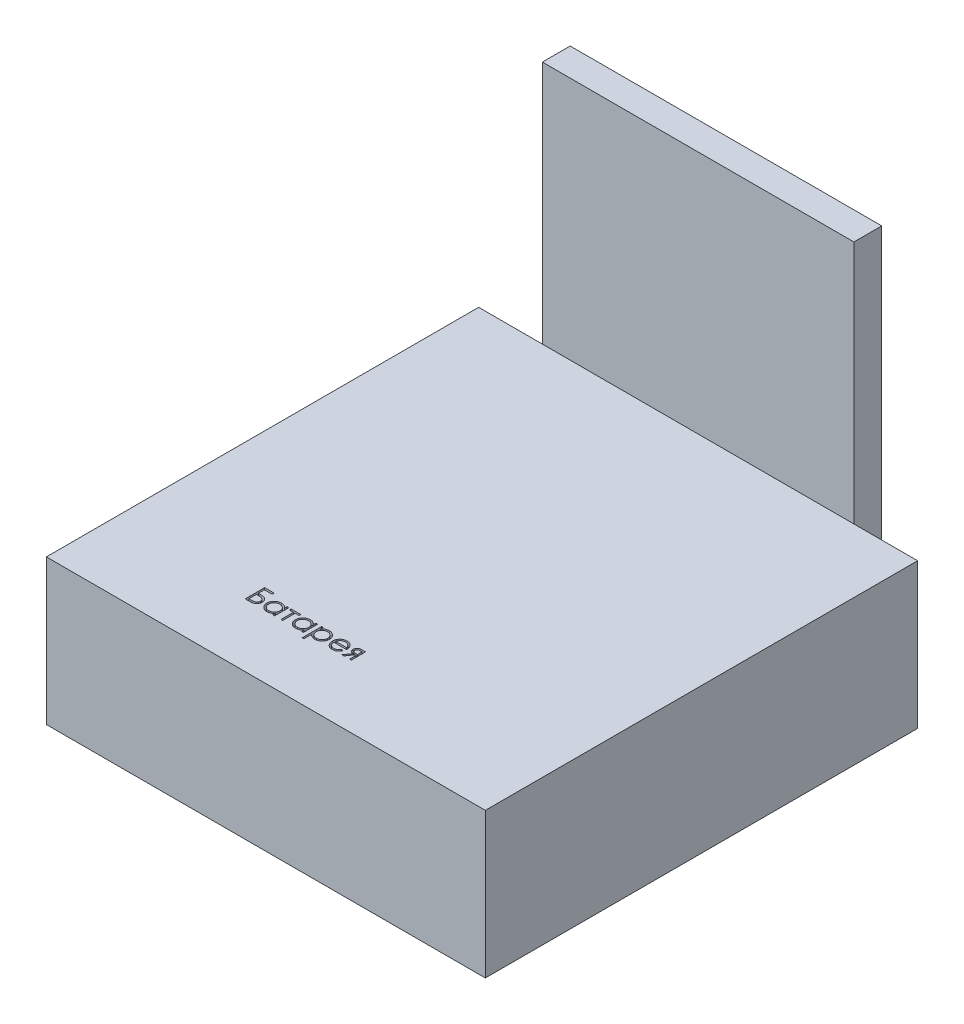
from build123d import *

# Parameters (mm, degrees)
SKETCH_1_W          = 78.9
SKETCH_1_H          = 77.7
EXTRUDE_1_DEPTH     = 26.1
SKETCH_2_W          = 56
SKETCH_2_H          = 70
EXTRUDE_2_DEPTH     = 5
CUT_EXTRUDE_1_DEPTH = 2


with BuildPart() as part:
    # Эскиз1 → Бобышка-Вытянуть1 (new body)
    with BuildSketch(Plane(origin=(0, 0, 0), x_dir=(1, 0, 0), z_dir=(0, 1, 0))):
        Rectangle(SKETCH_1_W, SKETCH_1_H)
    extrude(amount=EXTRUDE_1_DEPTH)

    # Эскиз2 → Бобышка-Вытянуть2 (add)
    with BuildSketch(Plane(origin=(0, 0, -38.85), x_dir=(-1, 0, 0), z_dir=(0, 0, -1))):
        with Locations((0, 35)):
            Rectangle(SKETCH_2_W, SKETCH_2_H)
    extrude(amount=EXTRUDE_2_DEPTH)

    # Эскиз3 → Вырез-Вытянуть1 (cut)
    # profile 1 of 7: a face of its own
    with BuildSketch(Plane(origin=(0, 26.1, 0), x_dir=(1, 0, 0), z_dir=(0, 1, 0))):
        with BuildLine():
            Line((-15.046925595, -27.515967533), (-15.046925595, -24.015967533))
            Line((-15.046925595, -24.015967533), (-13.34179739, -24.015967533))
            Line((-13.34179739, -24.015967533), (-13.34179739, -24.374941892))
            Line((-13.34179739, -24.374941892), (-14.732823031, -24.374941892))
            Line((-14.732823031, -24.374941892), (-14.732823031, -25.451864968))
            Line((-14.732823031, -25.451864968), (-14.568760531, -25.451864968))
            add(Edge.make_bspline(
                [(-14.568760531, -25.451864968), (-14.516173328, -25.452374539), (-14.414481841, -25.453359932), (-14.267633745, -25.457887542), (-14.131954982, -25.466693536), (-14.007646498, -25.480445946), (-13.894211782, -25.49564601), (-13.792003014, -25.516248801), (-13.70096045, -25.539471013), (-13.61984913, -25.567238351), (-13.546942061, -25.599584406), (-13.478263971, -25.634283471), (-13.414424222, -25.674778427), (-13.353895611, -25.718679387), (-13.297924701, -25.767535752), (-13.244709257, -25.819309944), (-13.196430375, -25.876330214), (-13.152596853, -25.937320138), (-13.112424184, -26.00071343), (-13.078348078, -26.066882628), (-13.048551981, -26.134144185), (-13.024632293, -26.203613146), (-13.005684504, -26.274812608), (-12.9923796, -26.347958881), (-12.984570227, -26.422747979), (-12.983409921, -26.473147444), (-12.982823031, -26.498639808)],
                knots=[0, 0, 0, 0, 1.752767101, 3.389446175, 4.896203737, 6.282845301, 7.557379853, 8.70920821, 9.755888069, 10.687037128, 11.562572166, 12.412614865, 13.249022037, 14.079422943, 14.902337317, 15.723036774, 16.551865261, 17.38856255, 18.224969721, 19.050681129, 19.866895551, 20.674891587, 21.496773076, 22.320277089, 23.150385677, 24, 24, 24, 24], degree=3))
            add(Edge.make_bspline(
                [(-12.982823031, -26.498639808), (-12.983879099, -26.531864609), (-12.985969912, -26.597643371), (-12.999217081, -26.694775003), (-13.022676876, -26.788649616), (-13.05514546, -26.879489253), (-13.096391961, -26.967657501), (-13.148405948, -27.051762356), (-13.207923201, -27.133760427), (-13.277130388, -27.210838888), (-13.353794323, -27.282732944), (-13.439006542, -27.345289653), (-13.531776327, -27.398211261), (-13.631647863, -27.441755194), (-13.738850731, -27.475396956), (-13.852989122, -27.499053464), (-13.974321707, -27.513169537), (-14.057604145, -27.515017621), (-14.100411172, -27.515967533)],
                knots=[0, 0, 0, 0, 0.942308546, 1.865590965, 2.773834697, 3.681570429, 4.597712081, 5.528670488, 6.481825442, 7.467627989, 8.461905466, 9.457463404, 10.457951184, 11.484916399, 12.54140054, 13.638517739, 14.786202266, 16, 16, 16, 16], degree=3))
            Line((-14.100411172, -27.515967533), (-15.046925595, -27.515967533))
        make_face()
        with BuildLine():
            Line((-14.732823031, -25.810839327), (-14.732823031, -27.156993174))
            Line((-14.732823031, -27.156993174), (-14.285507326, -27.156993174))
            add(Edge.make_bspline(
                [(-14.285507326, -27.156993174), (-14.253485601, -27.156694461), (-14.191526142, -27.156116475), (-14.101987755, -27.152540521), (-14.01893086, -27.147276422), (-13.94269769, -27.138829659), (-13.87299833, -27.128321542), (-13.809863558, -27.116193503), (-13.753495352, -27.100604024), (-13.687784776, -27.077807348), (-13.614394486, -27.041432664), (-13.534720547, -26.988686536), (-13.464809739, -26.925022009), (-13.405238562, -26.851917111), (-13.356795348, -26.771822703), (-13.321902884, -26.685746552), (-13.300961265, -26.594758186), (-13.298284625, -26.532403156), (-13.296925595, -26.500743174)],
                knots=[0, 0, 0, 0, 1.143896666, 2.213347964, 3.200758521, 4.116267265, 4.952224007, 5.718489261, 6.411181601, 7.039613526, 8.200836304, 9.326180736, 10.443194696, 11.564568115, 12.684230914, 13.774114808, 14.86983476, 16, 16, 16, 16], degree=3))
            add(Edge.make_bspline(
                [(-13.296925595, -26.500743174), (-13.297191307, -26.480848201), (-13.297715488, -26.441600561), (-13.30599118, -26.384193812), (-13.317845589, -26.328805759), (-13.334329362, -26.275468742), (-13.357138408, -26.225028019), (-13.384136115, -26.176727582), (-13.41544889, -26.130434241), (-13.464332172, -26.072842985), (-13.53295729, -26.008205348), (-13.626113319, -25.94385766), (-13.729514557, -25.895377853), (-13.823373042, -25.867642717), (-13.904807883, -25.851456486), (-13.973289414, -25.84013484), (-14.048890169, -25.831336745), (-14.13138488, -25.823458204), (-14.221197545, -25.818192151), (-14.317962899, -25.814027582), (-14.421740077, -25.811013999), (-14.493270822, -25.810898799), (-14.530198832, -25.810839327)],
                knots=[0, 0, 0, 0, 0.745694433, 1.471062404, 2.170974676, 2.869732838, 3.560525162, 4.243483851, 4.943835283, 5.65329213, 7.073640697, 8.467108435, 9.882903723, 11.339060524, 12.126567834, 12.997150682, 13.942162707, 14.981203314, 16.105622371, 17.316668913, 18.614720415, 20, 20, 20, 20], degree=3))
            Line((-14.530198832, -25.810839327), (-14.732823031, -25.810839327))
        make_face(mode=Mode.SUBTRACT)
    # profile 2 of 7: a face of its own
    with BuildSketch(Plane(origin=(0, 26.1, 0), x_dir=(1, 0, 0), z_dir=(0, 1, 0))):
        with BuildLine():
            Line((-9.7520538, -24.958275225), (-9.7520538, -27.515967533))
            Line((-9.7520538, -27.515967533), (-10.066156364, -27.515967533))
            Line((-10.066156364, -27.515967533), (-10.066156364, -27.07355968))
            add(Edge.make_bspline(
                [(-10.066156364, -27.07355968), (-10.101575155, -27.113599274), (-10.17069537, -27.191737045), (-10.286136488, -27.293819218), (-10.408504666, -27.378197539), (-10.537205987, -27.446347455), (-10.672124231, -27.497539511), (-10.812960318, -27.53392567), (-10.959771699, -27.557319505), (-11.060024054, -27.559655527), (-11.110827839, -27.560839327)],
                knots=[0, 0, 0, 0, 1.074387032, 2.096679803, 3.090159297, 4.057316773, 5.018401886, 5.985159533, 6.978961417, 8, 8, 8, 8], degree=3))
            add(Edge.make_bspline(
                [(-11.110827839, -27.560839327), (-11.155995793, -27.559612955), (-11.245068998, -27.557194495), (-11.376098075, -27.538432191), (-11.502190324, -27.508301569), (-11.623464897, -27.46640068), (-11.739137042, -27.410819858), (-11.850197139, -27.34427861), (-11.956069831, -27.26503778), (-12.05514137, -27.174449752), (-12.14637337, -27.076054765), (-12.226434643, -26.971109218), (-12.293187723, -26.860066914), (-12.349007803, -26.74433376), (-12.392004148, -26.623018841), (-12.421977782, -26.496541673), (-12.440718229, -26.365051799), (-12.443135689, -26.275512276), (-12.444361493, -26.230110161)],
                knots=[0, 0, 0, 0, 1.033919861, 2.038935746, 3.024066025, 3.998881131, 4.97069526, 5.957263378, 6.95902576, 7.993208707, 9.027059324, 10.027763471, 11.009749337, 11.988697705, 12.965288445, 13.950418724, 14.960734635, 16, 16, 16, 16], degree=3))
            add(Edge.make_bspline(
                [(-12.444361493, -26.230110161), (-12.443108521, -26.185646457), (-12.440631464, -26.097744114), (-12.422178245, -25.968465416), (-12.391147236, -25.843947155), (-12.347599388, -25.724590212), (-12.291757433, -25.610250162), (-12.223829346, -25.500846137), (-12.143810222, -25.396076739), (-12.051557815, -25.298405512), (-11.951623044, -25.208184898), (-11.844714313, -25.129775853), (-11.733491032, -25.062059004), (-11.616228022, -25.008405528), (-11.494660917, -24.964996423), (-11.367707471, -24.934963455), (-11.235895892, -24.917266134), (-11.1464054, -24.91470337), (-11.101012134, -24.91340343)],
                knots=[0, 0, 0, 0, 1.020392517, 2.01726096, 2.990465484, 3.961182959, 4.928053699, 5.906110375, 6.912531644, 7.948652711, 8.985773172, 9.998621852, 10.987621588, 11.969261332, 12.953316658, 13.946091881, 14.958173133, 16, 16, 16, 16], degree=3))
            add(Edge.make_bspline(
                [(-11.101012134, -24.91340343), (-11.048812275, -24.914841182), (-10.946450815, -24.917660544), (-10.796722805, -24.941123272), (-10.655078327, -24.980761739), (-10.520423975, -25.034679237), (-10.393243289, -25.106327966), (-10.274740305, -25.196707927), (-10.163674822, -25.305249114), (-10.09929453, -25.388619559), (-10.066156364, -25.431532436)],
                knots=[0, 0, 0, 0, 1.038897134, 2.037228247, 3.008116434, 3.962042015, 4.918381754, 5.904844433, 6.921570401, 8, 8, 8, 8], degree=3))
            Line((-10.066156364, -25.431532436), (-10.066156364, -24.958275225))
            Line((-10.066156364, -24.958275225), (-9.7520538, -24.958275225))
        make_face()
        with BuildLine():
            add(Edge.make_bspline(
                [(-11.096805403, -25.227505994), (-11.142719741, -25.229139632), (-11.233347341, -25.232364173), (-11.366391343, -25.257537668), (-11.493704757, -25.299422262), (-11.614650831, -25.356704164), (-11.727319048, -25.4287329), (-11.828012719, -25.515854283), (-11.91755542, -25.615691298), (-11.992863684, -25.727793408), (-12.054254181, -25.847971499), (-12.097421213, -25.973595937), (-12.12589046, -26.102400915), (-12.128798981, -26.189763601), (-12.130258929, -26.23361577)],
                knots=[0, 0, 0, 0, 1.031046209, 2.035121221, 3.029706178, 4.034933723, 5.034054252, 6.02443088, 7.017295772, 8.038157696, 9.050218397, 10.03989886, 11.016116709, 12, 12, 12, 12], degree=3))
            add(Edge.make_bspline(
                [(-12.130258929, -26.23361577), (-12.128394035, -26.277205877), (-12.124671558, -26.364215233), (-12.097920864, -26.49319581), (-12.053040991, -26.618849852), (-11.991798928, -26.740110845), (-11.915112303, -26.852694946), (-11.826223651, -26.954435068), (-11.724273369, -27.041924656), (-11.611345862, -27.11516223), (-11.490737892, -27.174324751), (-11.36390396, -27.21549039), (-11.233228322, -27.242068171), (-11.144375988, -27.245172648), (-11.09960989, -27.246736763)],
                knots=[0, 0, 0, 0, 0.979072187, 1.954306742, 2.945804271, 3.96968567, 4.997920485, 5.998718438, 6.996577872, 8.005894225, 9.015743152, 10.005417472, 10.995077863, 12, 12, 12, 12], degree=3))
            add(Edge.make_bspline(
                [(-11.09960989, -27.246736763), (-11.054163387, -27.245076799), (-10.963774801, -27.241775296), (-10.830336093, -27.216494031), (-10.70084113, -27.174725232), (-10.577053902, -27.116826105), (-10.461737771, -27.04506875), (-10.358239893, -26.961061658), (-10.270723925, -26.863358474), (-10.196531315, -26.755982021), (-10.138355898, -26.638270025), (-10.095979839, -26.512935834), (-10.070925933, -26.379975086), (-10.067768204, -26.289111159), (-10.066156364, -26.242730353)],
                knots=[0, 0, 0, 0, 1.01762866, 2.023962475, 3.030623092, 4.058876274, 5.077231937, 6.066672613, 7.034107872, 8.005628644, 8.981990164, 9.965428785, 10.961468474, 12, 12, 12, 12], degree=3))
            add(Edge.make_bspline(
                [(-10.066156364, -26.242730353), (-10.067116021, -26.207392523), (-10.069004928, -26.137836489), (-10.083435498, -26.035708972), (-10.106390424, -25.937975246), (-10.138736594, -25.844532557), (-10.181227879, -25.755897541), (-10.232475644, -25.671433781), (-10.293381094, -25.59158057), (-10.36296379, -25.517437499), (-10.439128993, -25.449811036), (-10.519723534, -25.389446796), (-10.60570228, -25.339858023), (-10.695619317, -25.298816751), (-10.789630652, -25.266157601), (-10.888501272, -25.244369908), (-10.991180259, -25.229409587), (-11.061226314, -25.228147206), (-11.096805403, -25.227505994)],
                knots=[0, 0, 0, 0, 1.050140795, 2.067009409, 3.05949893, 4.030605086, 5.00011959, 5.97591094, 6.962425594, 7.979863591, 8.993523472, 9.986985069, 10.967611495, 11.937549037, 12.921786183, 13.919465291, 14.943216303, 16, 16, 16, 16], degree=3))
        make_face(mode=Mode.SUBTRACT)
    # profile 3 of 7: a face of its own
    with BuildSketch(Plane(origin=(0, 26.1, 0), x_dir=(1, 0, 0), z_dir=(0, 1, 0))):
        Polygon((-9.348207646, -24.958275225), (-7.598207646, -24.958275225), (-7.598207646, -25.272377789), (-8.316156364, -25.272377789), (-8.316156364, -27.515967533), (-8.630258929, -27.515967533), (-8.630258929, -25.272377789), (-9.348207646, -25.272377789), align=None)
    # profile 4 of 7: a face of its own
    with BuildSketch(Plane(origin=(0, 26.1, 0), x_dir=(1, 0, 0), z_dir=(0, 1, 0))):
        with BuildLine():
            Line((-4.59179739, -24.958275225), (-4.59179739, -27.515967533))
            Line((-4.59179739, -27.515967533), (-4.905899954, -27.515967533))
            Line((-4.905899954, -27.515967533), (-4.905899954, -27.07355968))
            add(Edge.make_bspline(
                [(-4.905899954, -27.07355968), (-4.941318745, -27.113599274), (-5.01043896, -27.191737045), (-5.125880078, -27.293819218), (-5.248248256, -27.378197539), (-5.376949577, -27.446347455), (-5.51186782, -27.497539511), (-5.652703908, -27.53392567), (-5.799515289, -27.557319505), (-5.899767643, -27.559655527), (-5.950571429, -27.560839327)],
                knots=[0, 0, 0, 0, 1.074387032, 2.096679803, 3.090159297, 4.057316773, 5.018401886, 5.985159533, 6.978961417, 8, 8, 8, 8], degree=3))
            add(Edge.make_bspline(
                [(-5.950571429, -27.560839327), (-5.995739382, -27.559612955), (-6.084812587, -27.557194495), (-6.215841664, -27.538432191), (-6.341933914, -27.508301569), (-6.463208487, -27.46640068), (-6.578880632, -27.410819858), (-6.689940729, -27.34427861), (-6.795813421, -27.26503778), (-6.89488496, -27.174449752), (-6.98611696, -27.076054765), (-7.066178233, -26.971109218), (-7.132931312, -26.860066914), (-7.188751393, -26.74433376), (-7.231747738, -26.623018841), (-7.261721372, -26.496541673), (-7.280461819, -26.365051799), (-7.282879279, -26.275512276), (-7.284105082, -26.230110161)],
                knots=[0, 0, 0, 0, 1.033919861, 2.038935746, 3.024066025, 3.998881131, 4.97069526, 5.957263378, 6.95902576, 7.993208707, 9.027059324, 10.027763471, 11.009749337, 11.988697705, 12.965288445, 13.950418724, 14.960734635, 16, 16, 16, 16], degree=3))
            add(Edge.make_bspline(
                [(-7.284105082, -26.230110161), (-7.282852111, -26.185646457), (-7.280375054, -26.097744114), (-7.261921834, -25.968465416), (-7.230890826, -25.843947155), (-7.187342978, -25.724590212), (-7.131501023, -25.610250162), (-7.063572936, -25.500846137), (-6.983553811, -25.396076739), (-6.891301404, -25.298405512), (-6.791366634, -25.208184898), (-6.684457903, -25.129775853), (-6.573234622, -25.062059004), (-6.455971611, -25.008405528), (-6.334404507, -24.964996423), (-6.207451061, -24.934963455), (-6.075639482, -24.917266134), (-5.98614899, -24.91470337), (-5.940755723, -24.91340343)],
                knots=[0, 0, 0, 0, 1.020392517, 2.01726096, 2.990465484, 3.961182959, 4.928053699, 5.906110375, 6.912531644, 7.948652711, 8.985773172, 9.998621852, 10.987621588, 11.969261332, 12.953316658, 13.946091881, 14.958173133, 16, 16, 16, 16], degree=3))
            add(Edge.make_bspline(
                [(-5.940755723, -24.91340343), (-5.888555864, -24.914841182), (-5.786194404, -24.917660544), (-5.636466395, -24.941123272), (-5.494821917, -24.980761739), (-5.360167565, -25.034679237), (-5.232986879, -25.106327966), (-5.114483895, -25.196707927), (-5.003418411, -25.305249114), (-4.93903812, -25.388619559), (-4.905899954, -25.431532436)],
                knots=[0, 0, 0, 0, 1.038897134, 2.037228247, 3.008116434, 3.962042015, 4.918381754, 5.904844433, 6.921570401, 8, 8, 8, 8], degree=3))
            Line((-4.905899954, -25.431532436), (-4.905899954, -24.958275225))
            Line((-4.905899954, -24.958275225), (-4.59179739, -24.958275225))
        make_face()
        with BuildLine():
            add(Edge.make_bspline(
                [(-5.936548993, -25.227505994), (-5.982463331, -25.229139632), (-6.07309093, -25.232364173), (-6.206134933, -25.257537668), (-6.333448347, -25.299422262), (-6.454394421, -25.356704164), (-6.567062638, -25.4287329), (-6.667756308, -25.515854283), (-6.75729901, -25.615691298), (-6.832607274, -25.727793408), (-6.893997771, -25.847971499), (-6.937164803, -25.973595937), (-6.96563405, -26.102400915), (-6.968542571, -26.189763601), (-6.970002518, -26.23361577)],
                knots=[0, 0, 0, 0, 1.031046209, 2.035121221, 3.029706178, 4.034933723, 5.034054252, 6.02443088, 7.017295772, 8.038157696, 9.050218397, 10.03989886, 11.016116709, 12, 12, 12, 12], degree=3))
            add(Edge.make_bspline(
                [(-6.970002518, -26.23361577), (-6.968137625, -26.277205877), (-6.964415148, -26.364215233), (-6.937664454, -26.49319581), (-6.89278458, -26.618849852), (-6.831542518, -26.740110845), (-6.754855893, -26.852694946), (-6.66596724, -26.954435068), (-6.564016959, -27.041924656), (-6.451089452, -27.11516223), (-6.330481481, -27.174324751), (-6.20364755, -27.21549039), (-6.072971912, -27.242068171), (-5.984119578, -27.245172648), (-5.93935348, -27.246736763)],
                knots=[0, 0, 0, 0, 0.979072187, 1.954306742, 2.945804271, 3.96968567, 4.997920485, 5.998718438, 6.996577872, 8.005894225, 9.015743152, 10.005417472, 10.995077863, 12, 12, 12, 12], degree=3))
            add(Edge.make_bspline(
                [(-5.93935348, -27.246736763), (-5.893906977, -27.245076799), (-5.803518391, -27.241775296), (-5.670079683, -27.216494031), (-5.54058472, -27.174725232), (-5.416797491, -27.116826105), (-5.30148136, -27.04506875), (-5.197983483, -26.961061658), (-5.110467514, -26.863358474), (-5.036274905, -26.755982021), (-4.978099488, -26.638270025), (-4.935723429, -26.512935834), (-4.910669523, -26.379975086), (-4.907511793, -26.289111159), (-4.905899954, -26.242730353)],
                knots=[0, 0, 0, 0, 1.01762866, 2.023962475, 3.030623092, 4.058876274, 5.077231937, 6.066672613, 7.034107872, 8.005628644, 8.981990164, 9.965428785, 10.961468474, 12, 12, 12, 12], degree=3))
            add(Edge.make_bspline(
                [(-4.905899954, -26.242730353), (-4.906859611, -26.207392523), (-4.908748518, -26.137836489), (-4.923179088, -26.035708972), (-4.946134014, -25.937975246), (-4.978480184, -25.844532557), (-5.020971468, -25.755897541), (-5.072219234, -25.671433781), (-5.133124684, -25.59158057), (-5.20270738, -25.517437499), (-5.278872583, -25.449811036), (-5.359467123, -25.389446796), (-5.44544587, -25.339858023), (-5.535362907, -25.298816751), (-5.629374242, -25.266157601), (-5.728244861, -25.244369908), (-5.830923848, -25.229409587), (-5.900969904, -25.228147206), (-5.936548993, -25.227505994)],
                knots=[0, 0, 0, 0, 1.050140795, 2.067009409, 3.05949893, 4.030605086, 5.00011959, 5.97591094, 6.962425594, 7.979863591, 8.993523472, 9.986985069, 10.967611495, 11.937549037, 12.921786183, 13.919465291, 14.943216303, 16, 16, 16, 16], degree=3))
        make_face(mode=Mode.SUBTRACT)
    # profile 5 of 7: a face of its own
    with BuildSketch(Plane(origin=(0, 26.1, 0), x_dir=(1, 0, 0), z_dir=(0, 1, 0))):
        with BuildLine():
            Line((-3.873848672, -24.958275225), (-3.559746108, -24.958275225))
            Line((-3.559746108, -24.958275225), (-3.559746108, -25.431532436))
            add(Edge.make_bspline(
                [(-3.559746108, -25.431532436), (-3.526388624, -25.388594703), (-3.461565029, -25.30515381), (-3.349840124, -25.197163681), (-3.231913315, -25.106088377), (-3.104749903, -25.034705844), (-2.970326213, -24.980885033), (-2.829193896, -24.941105583), (-2.680155131, -24.917664108), (-2.578258678, -24.914842447), (-2.526292582, -24.91340343)],
                knots=[0, 0, 0, 0, 1.0828784, 2.104357462, 3.088488658, 4.04616522, 5.001424249, 5.969181776, 6.964304535, 8, 8, 8, 8], degree=3))
            add(Edge.make_bspline(
                [(-2.526292582, -24.91340343), (-2.480900979, -24.914716609), (-2.391182091, -24.917312176), (-2.259118862, -24.934885231), (-2.131943478, -24.965002923), (-2.010375424, -25.008403838), (-1.893112359, -25.062059308), (-1.781890259, -25.129776344), (-1.674976704, -25.208182535), (-1.575060515, -25.298414685), (-1.482739147, -25.396042952), (-1.402892966, -25.501065256), (-1.334021062, -25.610027842), (-1.278350765, -25.724619935), (-1.234742418, -25.843939164), (-1.20372774, -25.968467605), (-1.185270097, -26.097743546), (-1.182793645, -26.185646266), (-1.18154098, -26.230110161)],
                knots=[0, 0, 0, 0, 1.041296284, 2.058176809, 3.050446431, 4.034000596, 5.01514041, 6.003636468, 7.015969324, 8.052561599, 9.08815499, 10.094063707, 11.074456064, 12.040834395, 13.011057502, 13.983766392, 14.980127149, 16, 16, 16, 16], degree=3))
            add(Edge.make_bspline(
                [(-1.18154098, -26.230110161), (-1.182766465, -26.275512469), (-1.1851833, -26.365052374), (-1.203928306, -26.496539471), (-1.23388518, -26.623026845), (-1.276943363, -26.744304108), (-1.332584851, -26.86028776), (-1.400289412, -26.970894156), (-1.480175879, -27.076087859), (-1.571477006, -27.174440759), (-1.670529943, -27.265040072), (-1.776407432, -27.344278142), (-1.887466358, -27.410819517), (-2.003138525, -27.466402476), (-2.124414163, -27.50829466), (-2.250727441, -27.538512461), (-2.382009587, -27.557146957), (-2.471310739, -27.559599099), (-2.516476877, -27.560839327)],
                knots=[0, 0, 0, 0, 1.038740735, 2.04854663, 3.033179607, 4.009277356, 4.987731542, 5.972001279, 6.972200261, 8.005528982, 9.039189865, 10.040446548, 11.026516639, 11.997840187, 12.972163198, 13.956796175, 14.96660207, 16, 16, 16, 16], degree=3))
            add(Edge.make_bspline(
                [(-2.516476877, -27.560839327), (-2.567304449, -27.55954452), (-2.667703805, -27.556986895), (-2.814501476, -27.531067485), (-2.955778328, -27.492330549), (-3.089969152, -27.435631556), (-3.218136965, -27.36337604), (-3.339556771, -27.275265834), (-3.454873523, -27.171485209), (-3.524282281, -27.092753393), (-3.559746108, -27.052526026)],
                knots=[0, 0, 0, 0, 1.014726462, 2.004382257, 2.969841629, 3.936926163, 4.907207904, 5.903978561, 6.929055279, 8, 8, 8, 8], degree=3))
            Line((-3.559746108, -27.052526026), (-3.559746108, -28.458275225))
            Line((-3.559746108, -28.458275225), (-3.873848672, -28.458275225))
            Line((-3.873848672, -28.458275225), (-3.873848672, -24.958275225))
        make_face()
        with BuildLine():
            add(Edge.make_bspline(
                [(-2.52909707, -25.227505994), (-2.564676632, -25.228146252), (-2.63472362, -25.229406756), (-2.737395839, -25.244380704), (-2.836291267, -25.266118446), (-2.930413218, -25.299030346), (-3.020663834, -25.339429159), (-3.106347999, -25.38991117), (-3.187405567, -25.449563176), (-3.263632597, -25.51724252), (-3.332495891, -25.591817208), (-3.393458819, -25.671405017), (-3.444666124, -25.755905157), (-3.487168144, -25.844530519), (-3.519511427, -25.937975805), (-3.542467146, -26.035708817), (-3.556897499, -26.13783653), (-3.558786436, -26.207392536), (-3.559746108, -26.242730353)],
                knots=[0, 0, 0, 0, 1.05670511, 2.080379991, 3.077984906, 4.06214886, 5.038337365, 6.01289324, 7.01187578, 8.025460281, 9.038092164, 10.024533457, 11.000252242, 11.969694649, 12.940728589, 13.933144304, 14.949937299, 16, 16, 16, 16], degree=3))
            add(Edge.make_bspline(
                [(-3.559746108, -26.242730353), (-3.558155252, -26.289118466), (-3.55503863, -26.379996707), (-3.529701262, -26.512780829), (-3.488465998, -26.638432484), (-3.429937284, -26.755893521), (-3.35598971, -26.863876356), (-3.266891554, -26.960566963), (-3.163449003, -27.045357554), (-3.047381811, -27.116778808), (-2.92295968, -27.174766874), (-2.793173768, -27.216281084), (-2.659808887, -27.241853313), (-2.569640568, -27.245100132), (-2.524189217, -27.246736763)],
                knots=[0, 0, 0, 0, 1.03728447, 2.032128127, 3.01272805, 3.987917167, 4.958271349, 5.931593992, 6.91984656, 7.941419022, 8.973179163, 9.983609215, 10.983593296, 12, 12, 12, 12], degree=3))
            add(Edge.make_bspline(
                [(-2.524189217, -27.246736763), (-2.479653449, -27.245180386), (-2.391257956, -27.242091258), (-2.261099835, -27.215353071), (-2.134609196, -27.174508046), (-2.014429024, -27.11494849), (-1.901605536, -27.041958432), (-1.799723982, -26.954398398), (-1.710717069, -26.852908455), (-1.634852714, -26.739899952), (-1.573721228, -26.618724569), (-1.527790989, -26.49334318), (-1.501282415, -26.364197757), (-1.497525627, -26.277200044), (-1.495643544, -26.23361577)],
                knots=[0, 0, 0, 0, 1.00104056, 1.986885549, 2.97790532, 3.984399681, 4.995088187, 5.994304198, 6.996462723, 8.023150851, 9.048424203, 10.043036403, 11.019596776, 12, 12, 12, 12], degree=3))
            add(Edge.make_bspline(
                [(-1.495643544, -26.23361577), (-1.497098278, -26.189760781), (-1.499996412, -26.102392477), (-1.528543449, -25.973629574), (-1.571443427, -25.847741598), (-1.634002479, -25.728221048), (-1.708203748, -25.615446965), (-1.797950745, -25.515893087), (-1.898566942, -25.428722414), (-2.011256106, -25.356707004), (-2.132196531, -25.299421509), (-2.259511447, -25.25753787), (-2.39255505, -25.232364121), (-2.483182704, -25.229139614), (-2.52909707, -25.227505994)],
                knots=[0, 0, 0, 0, 0.983928682, 1.960191568, 2.949917689, 3.96440592, 4.982380491, 5.975291189, 6.965713506, 7.964880129, 8.970154049, 9.96478489, 10.968906225, 12, 12, 12, 12], degree=3))
        make_face(mode=Mode.SUBTRACT)
    # profile 6 of 7: a face of its own
    with BuildSketch(Plane(origin=(0, 26.1, 0), x_dir=(1, 0, 0), z_dir=(0, 1, 0))):
        with BuildLine():
            Line((1.545822802, -26.708275225), (1.824869277, -26.85480968))
            add(Edge.make_bspline(
                [(1.824869277, -26.85480968), (1.802632681, -26.894253011), (1.759369073, -26.970994114), (1.684968325, -27.076425975), (1.606976252, -27.17127369), (1.521872284, -27.253003345), (1.432202605, -27.32425473), (1.337469951, -27.386592554), (1.237181133, -27.439711075), (1.131331408, -27.484463603), (1.019031857, -27.518873097), (0.900010341, -27.543177318), (0.774038845, -27.558200586), (0.687692665, -27.559945727), (0.643479052, -27.560839327)],
                knots=[0, 0, 0, 0, 1.120438281, 2.179929193, 3.190490725, 4.156257408, 5.095198341, 6.022838206, 6.959905092, 7.901321166, 8.864066838, 9.862729781, 10.905609505, 12, 12, 12, 12], degree=3))
            add(Edge.make_bspline(
                [(0.643479052, -27.560839327), (0.594337075, -27.559692152), (0.498475313, -27.557454345), (0.358935566, -27.538161881), (0.227556148, -27.506689522), (0.104344444, -27.462723981), (-0.010397808, -27.405296657), (-0.116898663, -27.335337175), (-0.215718189, -27.25320492), (-0.303742398, -27.158188477), (-0.382986281, -27.056506519), (-0.452912101, -26.950550635), (-0.511369532, -26.84058741), (-0.558922142, -26.727316886), (-0.597327007, -26.611452993), (-0.624093711, -26.491941525), (-0.639523459, -26.369105941), (-0.641887904, -26.286008605), (-0.643079441, -26.244132597)],
                knots=[0, 0, 0, 0, 1.145258523, 2.234067595, 3.276747158, 4.290159414, 5.277019952, 6.260822364, 7.254936242, 8.264827045, 9.274100331, 10.257902744, 11.220704747, 12.172965371, 13.118907548, 14.062713208, 15.023725156, 16, 16, 16, 16], degree=3))
            add(Edge.make_bspline(
                [(-0.643079441, -26.244132597), (-0.6420203, -26.204837766), (-0.639921222, -26.126960602), (-0.626690434, -26.011695057), (-0.603242141, -25.899666605), (-0.571065817, -25.790782157), (-0.529514571, -25.685224023), (-0.478682352, -25.582927959), (-0.418489974, -25.484002819), (-0.3720173, -25.421599685), (-0.348608288, -25.390166251)],
                knots=[0, 0, 0, 0, 1.024358464, 2.0301432, 3.019427413, 4.004406732, 4.986367066, 5.972626655, 6.978780325, 8, 8, 8, 8], degree=3))
            add(Edge.make_bspline(
                [(-0.348608288, -25.390166251), (-0.316900605, -25.35229738), (-0.254489658, -25.27775923), (-0.148933303, -25.179820904), (-0.034633106, -25.097777129), (0.08697852, -25.029769993), (0.217314994, -24.978096346), (0.354624285, -24.939588764), (0.500469871, -24.918010753), (0.600175092, -24.914962919), (0.651191392, -24.91340343)],
                knots=[0, 0, 0, 0, 1.030682036, 2.02871468, 2.997146059, 3.962720338, 4.930598197, 5.918074684, 6.934738563, 8, 8, 8, 8], degree=3))
            add(Edge.make_bspline(
                [(0.651191392, -24.91340343), (0.703638997, -24.914757479), (0.806529243, -24.917413814), (0.956561364, -24.942040148), (1.098522081, -24.981092702), (1.232354585, -25.036246493), (1.358072446, -25.107406044), (1.474858495, -25.195547886), (1.584710008, -25.297965973), (1.648618587, -25.376729183), (1.681139309, -25.416808879)],
                knots=[0, 0, 0, 0, 1.056321875, 2.072262726, 3.055038591, 4.01806755, 4.982017516, 5.957941055, 6.960871419, 8, 8, 8, 8], degree=3))
            add(Edge.make_bspline(
                [(1.681139309, -25.416808879), (1.703266247, -25.44701246), (1.74737284, -25.507218579), (1.80261994, -25.605389736), (1.850577335, -25.70810033), (1.888910296, -25.817010627), (1.919949797, -25.930830208), (1.942406616, -26.050372752), (1.955576235, -26.175602664), (1.958164932, -26.260929219), (1.959484661, -26.304429071)],
                knots=[0, 0, 0, 0, 0.94817472, 1.890038105, 2.849395472, 3.817997239, 4.812318967, 5.836947057, 6.897266129, 8, 8, 8, 8], degree=3))
            Line((1.959484661, -26.304429071), (-0.328976877, -26.304429071))
            add(Edge.make_bspline(
                [(-0.328976877, -26.304429071), (-0.327437271, -26.338129535), (-0.324409697, -26.404400139), (-0.310294554, -26.501370922), (-0.28804578, -26.593744264), (-0.256776717, -26.680827306), (-0.218909872, -26.763757434), (-0.172524155, -26.841919471), (-0.117184601, -26.914957401), (-0.055458902, -26.983524538), (0.013248193, -27.0445853), (0.085530941, -27.099237076), (0.162424506, -27.145042673), (0.243322589, -27.182222562), (0.328094374, -27.211328878), (0.416766569, -27.231196699), (0.509164686, -27.244503806), (0.57215042, -27.245983471), (0.604216232, -27.246736763)],
                knots=[0, 0, 0, 0, 1.094153842, 2.151609401, 3.174256925, 4.172055639, 5.149267565, 6.128595816, 7.11444997, 8.118368179, 9.117203808, 10.09244225, 11.054858984, 12.015122123, 12.976791628, 13.957293641, 14.960065497, 16, 16, 16, 16], degree=3))
            add(Edge.make_bspline(
                [(0.604216232, -27.246736763), (0.635567379, -27.246128707), (0.69777407, -27.244922206), (0.790414928, -27.233190295), (0.881554455, -27.214220019), (0.970815438, -27.188330029), (1.056386284, -27.156753177), (1.135631834, -27.118650319), (1.20851205, -27.076500573), (1.276629016, -27.028290897), (1.34270001, -26.96928271), (1.408242496, -26.895646989), (1.47851915, -26.808559462), (1.522508742, -26.743013796), (1.545822802, -26.708275225)],
                knots=[0, 0, 0, 0, 0.99110716, 1.966546729, 2.947904876, 3.932708344, 4.903319531, 5.828989031, 6.710028674, 7.56322171, 8.463672341, 9.504779593, 10.677557249, 12, 12, 12, 12], degree=3))
        make_face()
        with BuildLine():
            add(Edge.make_bspline(
                [(1.645382097, -25.990326507), (1.633885473, -25.948663633), (1.611758171, -25.868476013), (1.565521807, -25.757435122), (1.513450266, -25.658747221), (1.451828535, -25.573167588), (1.382009809, -25.497164075), (1.301364626, -25.43074549), (1.210928733, -25.371328039), (1.111169592, -25.321175539), (1.005527807, -25.278485681), (0.894921615, -25.249860565), (0.782063827, -25.230251023), (0.705729541, -25.228424914), (0.667317193, -25.227505994)],
                knots=[0, 0, 0, 0, 1.154881502, 2.222775134, 3.210006277, 4.132804581, 5.035138423, 5.962687519, 6.919655026, 7.923214229, 8.944639381, 9.960483929, 10.97369054, 12, 12, 12, 12], degree=3))
            add(Edge.make_bspline(
                [(0.667317193, -25.227505994), (0.635967755, -25.228117666), (0.573996506, -25.229326812), (0.482695438, -25.240796941), (0.395015739, -25.259756786), (0.310310451, -25.285721743), (0.229689583, -25.320330345), (0.151494814, -25.360913572), (0.077714418, -25.410455155), (0.031573123, -25.44821401), (0.008262706, -25.467289648)],
                knots=[0, 0, 0, 0, 1.04873581, 2.073130211, 3.073294108, 4.04793562, 5.032784715, 6.005352987, 6.992311501, 8, 8, 8, 8], degree=3))
            add(Edge.make_bspline(
                [(0.008262706, -25.467289648), (-0.008430576, -25.482383964), (-0.04221371, -25.51293118), (-0.087354232, -25.565560386), (-0.130574704, -25.622311948), (-0.169908357, -25.685357073), (-0.205985943, -25.753977852), (-0.239745921, -25.827595487), (-0.270132333, -25.906768617), (-0.287228443, -25.961941057), (-0.296024153, -25.990326507)],
                knots=[0, 0, 0, 0, 0.879870761, 1.780643979, 2.707998968, 3.669668524, 4.684282772, 5.740141944, 6.837334558, 8, 8, 8, 8], degree=3))
            Line((-0.296024153, -25.990326507), (1.645382097, -25.990326507))
        make_face(mode=Mode.SUBTRACT)
    # profile 7 of 7: a face of its own
    with BuildSketch(Plane(origin=(0, 26.1, 0), x_dir=(1, 0, 0), z_dir=(0, 1, 0))):
        with BuildLine():
            Line((3.709484661, -26.394172661), (3.496343636, -26.394172661))
            Line((3.496343636, -26.394172661), (2.727914148, -27.515967533))
            Line((2.727914148, -27.515967533), (2.352112866, -27.515967533))
            Line((2.352112866, -27.515967533), (3.142978251, -26.361219936))
            add(Edge.make_bspline(
                [(3.142978251, -26.361219936), (3.119529365, -26.357892874), (3.073448329, -26.351354632), (3.006592832, -26.334610269), (2.942777396, -26.314869305), (2.882585382, -26.289189389), (2.825897463, -26.259053056), (2.772183682, -26.224651844), (2.722185884, -26.185183251), (2.676198826, -26.141053053), (2.634194718, -26.093654708), (2.597107829, -26.043069849), (2.567469932, -25.988630915), (2.541694291, -25.93238186), (2.522092137, -25.873119216), (2.508121768, -25.81113445), (2.499483797, -25.746345825), (2.498464675, -25.702192451), (2.4979462, -25.679729552)],
                knots=[0, 0, 0, 0, 1.099506663, 2.160717016, 3.197657651, 4.19985706, 5.195507425, 6.177268612, 7.159029799, 8.149635859, 9.134214501, 10.098470414, 11.055979335, 12.008427587, 12.969745181, 13.949523313, 14.956825992, 16, 16, 16, 16], degree=3))
            add(Edge.make_bspline(
                [(2.4979462, -25.679729552), (2.498713674, -25.651896945), (2.500207685, -25.597716321), (2.509067561, -25.518774186), (2.525198175, -25.444502825), (2.54833277, -25.375289799), (2.577387894, -25.31066564), (2.612121663, -25.250597726), (2.65505625, -25.196347034), (2.703150562, -25.146682302), (2.756680796, -25.102476027), (2.814468184, -25.06374747), (2.876346765, -25.030559058), (2.942463027, -25.003978993), (3.012297499, -24.983749013), (3.085925071, -24.969013834), (3.163535435, -24.959635989), (3.216802418, -24.958734498), (3.243939789, -24.958275225)],
                knots=[0, 0, 0, 0, 1.138097104, 2.215488154, 3.242594759, 4.239751157, 5.193474932, 6.135785681, 7.068552318, 8.014586196, 8.957865405, 9.901338186, 10.854631051, 11.823457301, 12.809194096, 13.823013673, 14.890913606, 16, 16, 16, 16], degree=3))
            Line((3.243939789, -24.958275225), (4.023587225, -24.958275225))
            Line((4.023587225, -24.958275225), (4.023587225, -27.515967533))
            Line((4.023587225, -27.515967533), (3.709484661, -27.515967533))
            Line((3.709484661, -27.515967533), (3.709484661, -26.394172661))
        make_face()
        with BuildLine():
            Line((3.709484661, -25.272377789), (3.487229052, -25.272377789))
            add(Edge.make_bspline(
                [(3.487229052, -25.272377789), (3.461289452, -25.272608252), (3.411743484, -25.273048448), (3.340870671, -25.273728633), (3.276902458, -25.278116453), (3.219273605, -25.280655674), (3.168366727, -25.286687285), (3.123854794, -25.292680753), (3.086041783, -25.300057741), (3.04509993, -25.312197406), (3.000480973, -25.331089673), (2.953122477, -25.360658915), (2.911454534, -25.397366001), (2.875589329, -25.440913996), (2.846261186, -25.49212111), (2.826036194, -25.551564649), (2.814367261, -25.618741046), (2.81284577, -25.666125823), (2.812048764, -25.690947501)],
                knots=[0, 0, 0, 0, 1.350660357, 2.57983065, 3.688753965, 4.688351704, 5.581905617, 6.356248057, 7.026793086, 7.585046774, 8.577211351, 9.539376817, 10.479123443, 11.455948996, 12.464100545, 13.533882574, 14.708167992, 16, 16, 16, 16], degree=3))
            add(Edge.make_bspline(
                [(2.812048764, -25.690947501), (2.813176019, -25.714864844), (2.815356199, -25.761122427), (2.830764809, -25.827629258), (2.857774275, -25.887205299), (2.894360923, -25.939168094), (2.937806709, -25.98209227), (2.984246249, -26.017009021), (3.033220414, -26.042645149), (3.076805571, -26.057043384), (3.115594781, -26.062823937), (3.150548264, -26.068239414), (3.19206188, -26.070953224), (3.239435398, -26.075086003), (3.292792334, -26.076430368), (3.352121271, -26.079201189), (3.417587848, -26.079256312), (3.463392194, -26.079791554), (3.487229052, -26.080070097)],
                knots=[0, 0, 0, 0, 1.279504307, 2.474638368, 3.627611953, 4.758674305, 5.855194368, 6.88317955, 7.856461529, 8.801701345, 9.321856547, 9.953242351, 10.693726644, 11.546413696, 12.497591214, 13.54874432, 14.724351751, 16, 16, 16, 16], degree=3))
            Line((3.487229052, -26.080070097), (3.709484661, -26.080070097))
            Line((3.709484661, -26.080070097), (3.709484661, -25.272377789))
        make_face(mode=Mode.SUBTRACT)
    extrude(amount=-CUT_EXTRUDE_1_DEPTH, mode=Mode.SUBTRACT)


solid = part.part
